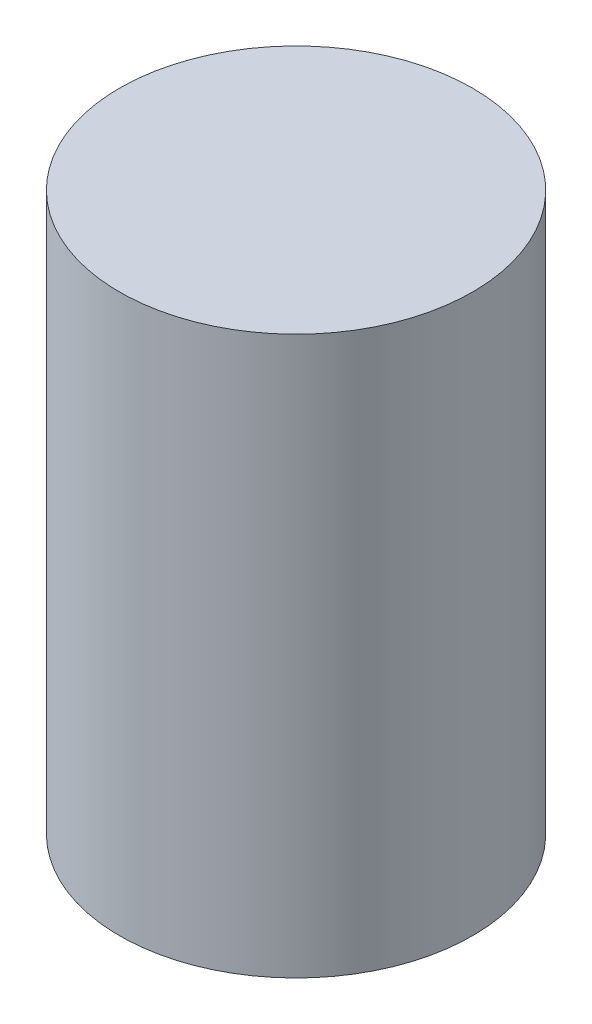
from build123d import *

# Parameters (mm, degrees)
SKETCH1_R           = 4.826
BOSS_EXTRUDE1_DEPTH = 15.24


with BuildPart() as part:
    # Sketch1 → Boss-Extrude1 (new body)
    with BuildSketch(Plane(origin=(0, 0, 0), x_dir=(1, 0, 0), z_dir=(0, 1, 0))):
        with Locations(Location((0, 0, 0), (0, 0, 90))):
            Circle(SKETCH1_R)
    extrude(amount=BOSS_EXTRUDE1_DEPTH)


solid = part.part
